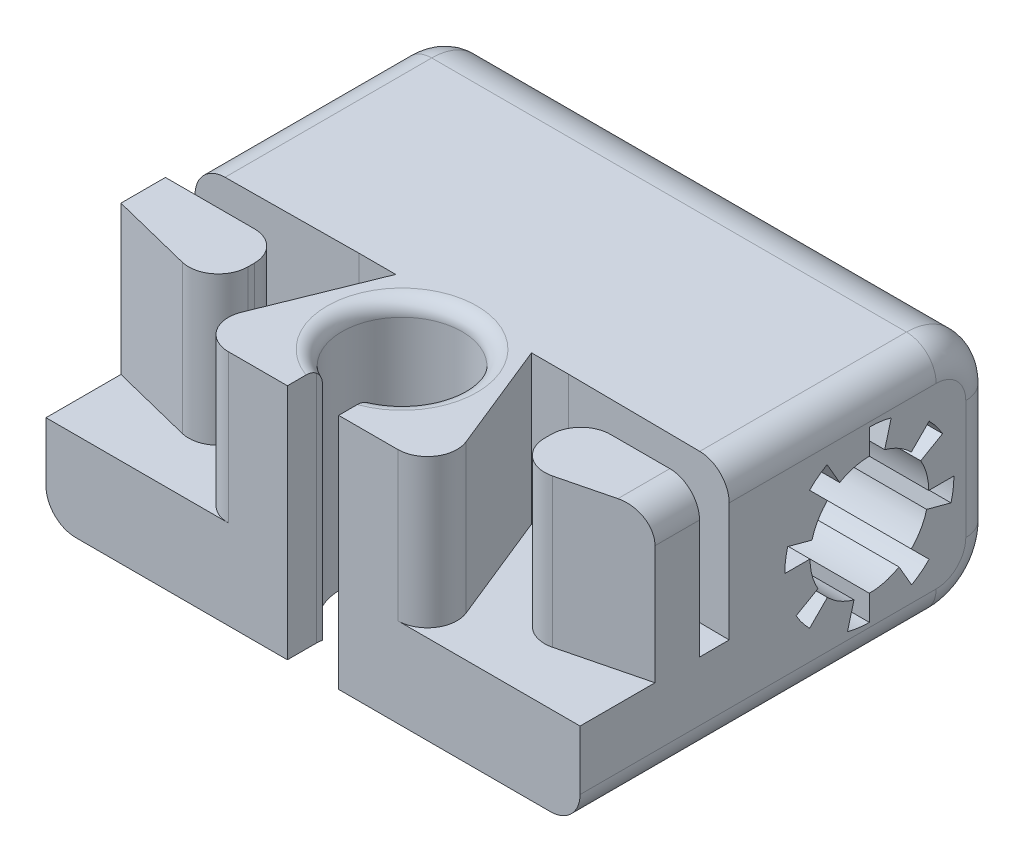
from build123d import *

# Parameters (mm, degrees)
SALIENTE_EXTRUIR1_DEPTH = 16
CROQUIS5_R              = 5.7
CORTAR_EXTRUIR1_DEPTH   = 38
SALIENTE_EXTRUIR2_DEPTH = 0.3
CORTAR_EXTRUIR2_DEPTH   = 10
REDONDEO1_R             = 4
REDONDEO2_R             = 2
REDONDEO3_R             = 1
FILETE1_R               = 2
SALIENTE_EXTRUIR3_START = -36
SALIENTE_EXTRUIR3_DEPTH = 36
PADR_OCIRCULAR1_COUNT   = 8
FILETE2_R               = 2
FILETE3_R               = 2


with BuildPart() as part:
    # Croquis1 → Saliente-Extruir1 (new body)
    with BuildSketch(Plane(origin=(0, 0, 0), x_dir=(1, 0, 0), z_dir=(0, 1, 0))):
        with BuildLine():
            Line((-16.125, 9.1375), (19.875, 9.1375))
            Line((19.875, 9.1375), (19.875, -18.8625))
            Line((19.875, -18.8625), (3.603278106, -18.8625))
            Line((3.603278106, -18.8625), (3.603278106, -16.9125))
            ThreePointArc((3.603278106, -16.9125), (3.593299591, -16.727049938), (3.563479273, -16.543741332))
            ThreePointArc((3.563479273, -16.543741332), (1.875, -8.8125), (0.186520727, -16.543741332))
            ThreePointArc((0.186520727, -16.543741332), (0.156700409, -16.727049938), (0.146721894, -16.9125))
            Line((0.146721894, -16.9125), (0.146721894, -18.8625))
            Line((0.146721894, -18.8625), (-16.125, -18.8625))
            Line((-16.125, -18.8625), (-16.125, 9.1375))
        make_face()
    extrude(amount=SALIENTE_EXTRUIR1_DEPTH)

    # Croquis5 → Cortar-Extruir1 (cut)
    with BuildSketch(Plane(origin=(19.875, 0, 0), x_dir=(0, 0, -1), z_dir=(1, 0, 0))):
        with Locations((0.6375, 8)):
            Circle(CROQUIS5_R)
    extrude(amount=-CORTAR_EXTRUIR1_DEPTH, mode=Mode.SUBTRACT)

    # Croquis8 → Saliente-Extruir2 (add)
    with BuildSketch(Plane.XZ):
        with BuildLine():
            Line((-2.175, 12.8625), (5.925, 12.8625))
            ThreePointArc((5.925, 12.8625), (1.875, 8.8125), (-2.175, 12.8625))
        make_face()
    extrude(amount=-SALIENTE_EXTRUIR2_DEPTH)

    # Croquis9 → Cortar-Extruir2 (cut)
    with BuildSketch(Plane(origin=(0, 16, 0), x_dir=(1, 0, 0), z_dir=(0, 1, 0))):
        Polygon((-8.125, -10.8125), (-8.125, -15.8125), (-16.125, -13.8125), (-16.125, -18.8625), (-6.801553451, -18.8625), (-2.700687259, -8.7125), (-5.179202857, -8.7125), (-16.125, -8.8125), (-16.125, -10.8125), align=None)
    cortar_extruir2 = extrude(amount=-CORTAR_EXTRUIR2_DEPTH, mode=Mode.SUBTRACT)

    # Redondeo1
    redondeo1_edges = [part.edges().sort_by_distance(p)[0] for p in [
        (1.875, 16, -9.1375),
        (1.875, 0, -9.1375),
    ]]
    fillet(redondeo1_edges, radius=REDONDEO1_R)

    # Redondeo2
    redondeo2_edges = [part.edges().sort_by_distance(p)[0] for p in [
        (-16.125, 16, 1.8375),
        (-16.125, 14.828427125, -7.965927125),
        (-16.125, 8, -9.1375),
        (-16.125, 1.171572875, -7.965927125),
        (19.875, 0, 6.8625),
        (19.875, 16, 6.8625),
        (-16.125, 0, 6.8625),
        (19.875, 1.171572875, -7.965927125),
        (19.875, 8, -9.1375),
        (19.875, 14.828427125, -7.965927125),
    ]]
    fillet(redondeo2_edges, radius=REDONDEO2_R)

    # Redondeo3
    redondeo3_edges = [part.edges().sort_by_distance(p)[0] for p in [
        (1.875, 16, 8.8125),
    ]]
    fillet(redondeo3_edges, radius=REDONDEO3_R)

    # Filete1
    filete1_edges = [part.edges().sort_by_distance(p)[0] for p in [
        (-8.125, 11, 15.8125),
        (-8.125, 11, 10.8125),
    ]]
    fillet(filete1_edges, radius=FILETE1_R)

    # Croquis10 → Saliente-Extruir3 (add)
    with BuildSketch(Plane.ZY.offset(16.125).offset(SALIENTE_EXTRUIR3_START)):
        with BuildLine():
            Line((-0.6375, 4), (-0.6375, 2.3))
            ThreePointArc((-0.6375, 2.3), (-2.112768557, 2.49422279), (-3.4875, 3.063655198))
            Line((-3.4875, 3.063655198), (-2.6375, 4.535898385))
            ThreePointArc((-2.6375, 4.535898385), (-1.67277618, 4.136296695), (-0.6375, 4))
        make_face()
    saliente_extruir3 = extrude(amount=SALIENTE_EXTRUIR3_DEPTH)

    # PadrãoCircular1: Saliente-Extruir3 ×8 about axis
    padr_ocircular1_axis = Axis((-16.125, 8, -0.6375), (1, 0, 0))
    for i in range(1, PADR_OCIRCULAR1_COUNT):
        add(saliente_extruir3.rotate(padr_ocircular1_axis, i * 360 / PADR_OCIRCULAR1_COUNT))

    # Filete2
    filete2_edges = [part.edges().sort_by_distance(p)[0] for p in [
        (-6.801553451, 11, 18.8625),
    ]]
    fillet(filete2_edges, radius=FILETE2_R)

    # Espelhar3: Cortar-Extruir2 across plane
    add(cortar_extruir2.mirror(Plane.ZY.offset(-1.875)), mode=Mode.SUBTRACT)

    # Filete3
    filete3_edges = [part.edges().sort_by_distance(p)[0] for p in [
        (10.551553451, 11, 18.8625),
        (11.875, 11, 15.8125),
        (11.875, 11, 10.8125),
    ]]
    fillet(filete3_edges, radius=FILETE3_R)


solid = part.part
